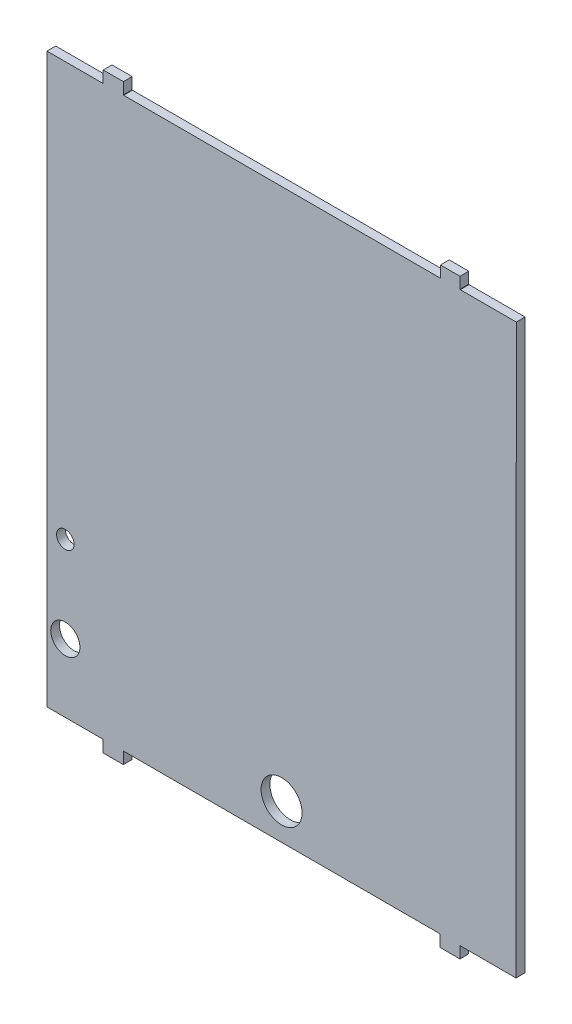
from build123d import *

# Parameters (mm, degrees)
MODEL_R             = 35.6997
MODEL_R_2           = 25.4
MODEL_R_3           = 15.24
BOSS_EXTRUDE2_DEPTH = 15.24
SCALE1_SCALE        = 0.1


with BuildPart() as part:
    # Model → Boss-Extrude2 (new body)
    with BuildSketch(Plane.XY):
        Polygon((683.6156, 410.2862), (683.133, 409.8036), (683.133, 389.7376), (648.0048, 389.7376), (648.0048, 409.702), (647.4968, 410.2862), (550.0116, 410.2862), (550.0116, 1399.2352), (647.4968, 1399.2352), (648.0048, 1399.7432), (648.0048, 1419.7076), (683.133, 1419.7076), (683.133, 1399.8448), (683.641, 1399.3368), (1234.7448, 1399.3368), (1235.202, 1399.8448), (1235.202, 1419.3012), (1269.238, 1419.3012), (1269.238, 1399.7432), (1269.7206, 1399.2352), (1367.3074, 1399.2352), (1366.8248, 409.829), (1269.238, 409.9052), (1269.238, 409.8036), (1269.238, 389.7376), (1234.0844, 389.7376), (1234.0844, 409.8036), (1233.5764, 410.2862), align=None)
        with Locations((958.6214, 472.313)):
            Circle(MODEL_R, mode=Mode.SUBTRACT)
        with Locations((582.0156, 528.8026)):
            Circle(MODEL_R_2, mode=Mode.SUBTRACT)
        with Locations((582.0156, 678.815)):
            Circle(MODEL_R_3, mode=Mode.SUBTRACT)
    extrude(amount=BOSS_EXTRUDE2_DEPTH)


with BuildPart() as part_1:
    # Scale1: scaled about (959.835155039, 908.097861416, 7.62)
    add(part.part.scale(SCALE1_SCALE).moved(Location((863.851639535, 817.288075274, 6.858))))


solid = part_1.part
